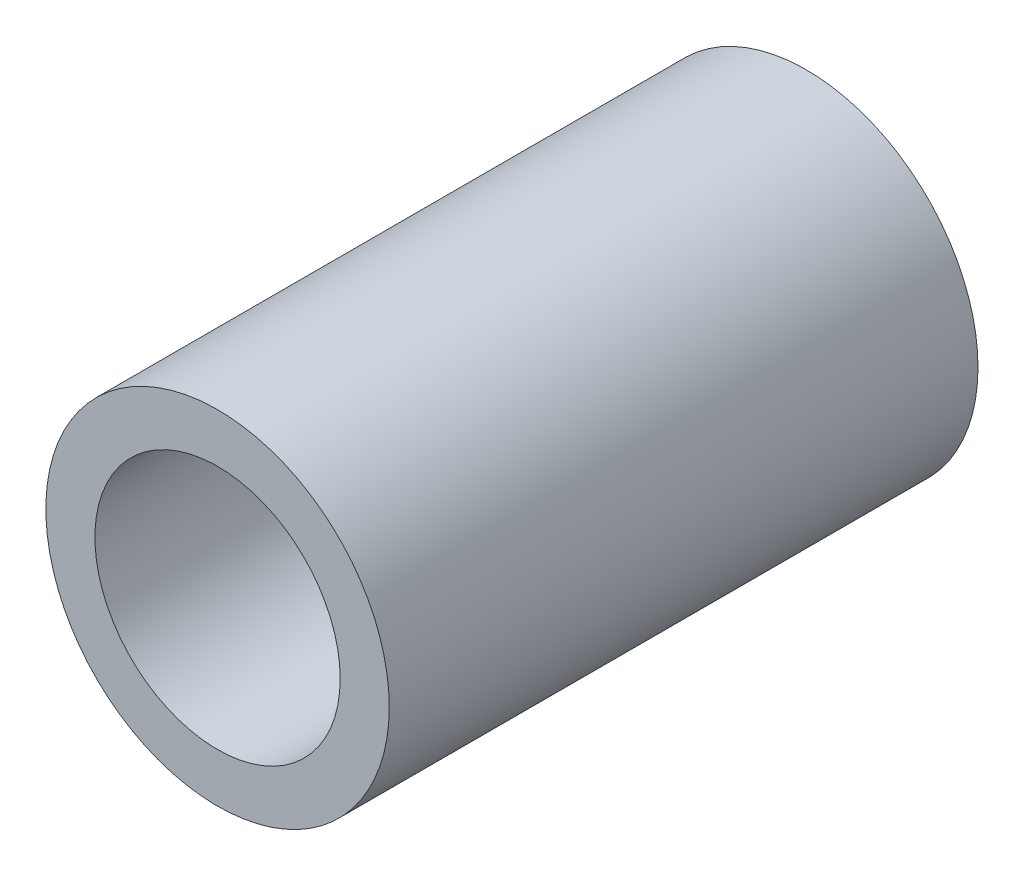
from build123d import *

# Parameters (mm, degrees)
SKETCH1_R           = 35
SKETCH1_R_2         = 20
BOSS_EXTRUDE1_DEPTH = 10
SKETCH2_R           = 35
SKETCH2_R_2         = 25
BOSS_EXTRUDE2_DEPTH = 110


with BuildPart() as part:
    # Sketch1 → Boss-Extrude1 (new body)
    with BuildSketch(Plane.XY):
        Circle(SKETCH1_R)
        Circle(SKETCH1_R_2, mode=Mode.SUBTRACT)
    extrude(amount=BOSS_EXTRUDE1_DEPTH)

    # Sketch2 → Boss-Extrude2 (add)
    with BuildSketch(Plane.XY.offset(10)):
        Circle(SKETCH2_R)
        Circle(SKETCH2_R_2, mode=Mode.SUBTRACT)
    extrude(amount=BOSS_EXTRUDE2_DEPTH)


solid = part.part
